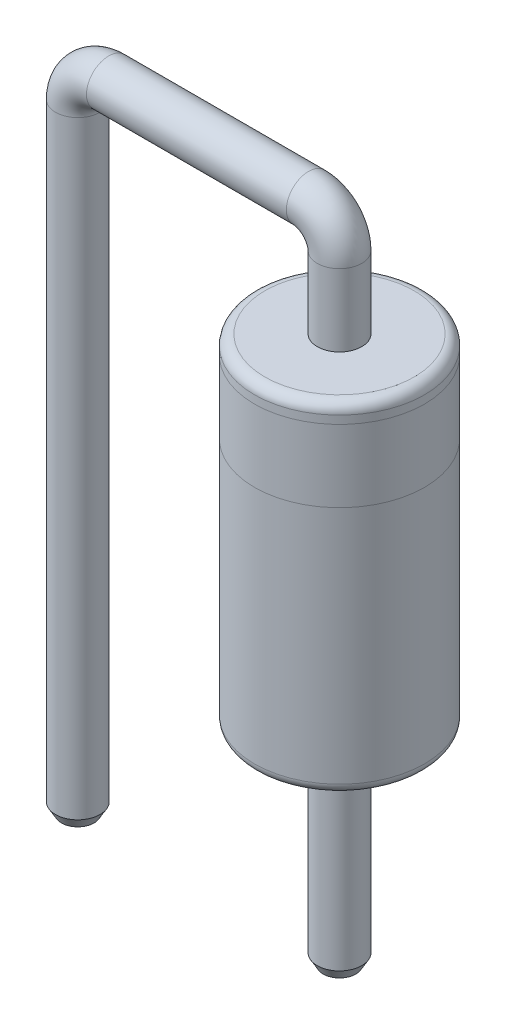
from build123d import *
from OCP.BRepFilletAPI import BRepFilletAPI_MakeChamfer

# Parameters (mm, degrees)
SKETCH1_R      = 0.2159
SKETCH3_R      = 0.825
EXTRUDE1_DEPTH = 3.302
FILLET1_R      = 0.1
CHAMFER1_SIZE  = 0.1
CHAMFER1_SIZE2 = 0.057735027


with BuildPart() as part:
    # Sweep1: sweep along a path in Sketch2
    with BuildLine(Plane.XY) as sweep1_path:
        Line((0, 0), (0, 6.002))
        ThreePointArc((0, 6.002), (-0.087867966, 6.214132034), (-0.3, 6.302))
        Line((-0.3, 6.302), (-2.24, 6.302))
        ThreePointArc((-2.24, 6.302), (-2.452132034, 6.214132034), (-2.54, 6.002))
        Line((-2.54, 6.002), (-2.54, 0))
    # Sketch1 → Sweep1 (sweep)
    with BuildSketch(Plane(origin=(0, 0, 0), x_dir=(1, 0, 0), z_dir=(0, 1, 0))):
        Circle(SKETCH1_R)
    sweep(path=sweep1_path.line)

    # Sketch3 → Extrude1 (add)
    with BuildSketch(Plane(origin=(1.111, 2, 0), x_dir=(0, 0, -1), z_dir=(0, 1, 0))):
        with Locations((0, 1.111)):
            Circle(SKETCH3_R)
    extrude(amount=EXTRUDE1_DEPTH)

    # Fillet1
    fillet1_edges = [part.edges().sort_by_distance(p)[0] for p in [
        (0, 5.302, 0.825),
        (0, 2, 0.825),
    ]]
    fillet(fillet1_edges, radius=FILLET1_R)

    # Chamfer1: one chamfer whose edges measure the first distance from different faces: ONE call of the kernel's chamfer builder (chamfer() names one face for all edges)
    chamfer1_edges_1 = [part.edges().sort_by_distance(p)[0] for p in [
        (-0.2159, 0, 0),
    ]]
    chamfer1_side_1 = [part.faces().sort_by_distance(p)[0] for p in [
        (-0.2159, 1, 0),
    ]]
    chamfer1_edges_2 = [part.edges().sort_by_distance(p)[0] for p in [
        (-2.3241, 0, 0),
    ]]
    chamfer1_side_2 = [part.faces().sort_by_distance(p)[0] for p in [
        (-2.3241, 3.001, 0),
    ]]
    chamfer1 = BRepFilletAPI_MakeChamfer(part.part.solid().wrapped)
    for e in chamfer1_edges_1:
        chamfer1.Add(CHAMFER1_SIZE, CHAMFER1_SIZE2, e.wrapped, chamfer1_side_1[0].wrapped)  # the first distance lies on this face
    for e in chamfer1_edges_2:
        chamfer1.Add(CHAMFER1_SIZE, CHAMFER1_SIZE2, e.wrapped, chamfer1_side_2[0].wrapped)  # the first distance lies on this face
    add(Compound.cast(chamfer1.Shape()), mode=Mode.REPLACE)


solid = part.part
